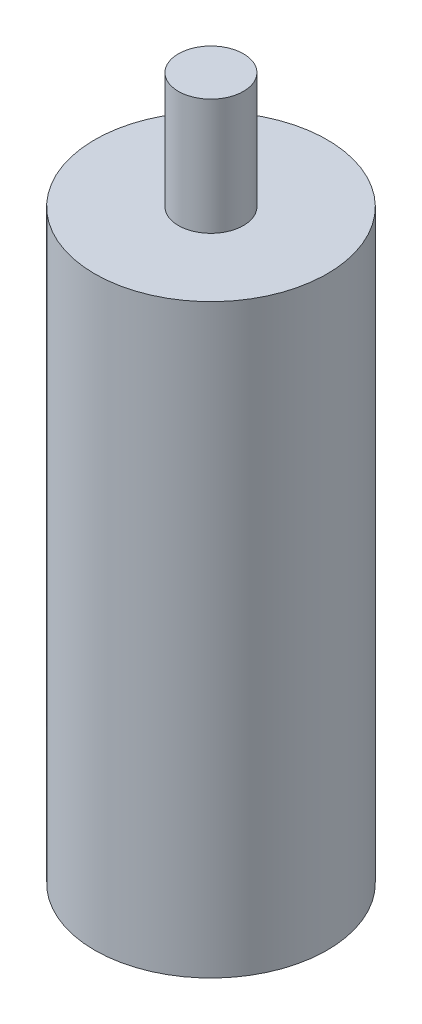
from build123d import *

# Parameters (mm, degrees)
SKETCH_1_R      = 12.5
EXTRUDE_1_DEPTH = 63
SKETCH_2_R      = 3.5
EXTRUDE_2_DEPTH = 12.5


with BuildPart() as part:
    # 草图1 → 凸台-拉伸1 (new body)
    with BuildSketch(Plane(origin=(0, 0, 0), x_dir=(1, 0, 0), z_dir=(0, 1, 0))):
        with Locations(Location((0, 0, 0), (0, 0, 270))):
            Circle(SKETCH_1_R)
    extrude(amount=EXTRUDE_1_DEPTH)

    # 草图2 → 凸台-拉伸2 (add)
    with BuildSketch(Plane(origin=(0, 63, 0), x_dir=(1, 0, 0), z_dir=(0, 1, 0))):
        with Locations(Location((0, 0, 0), (0, 0, 270))):
            Circle(SKETCH_2_R)
    extrude(amount=EXTRUDE_2_DEPTH)


solid = part.part
